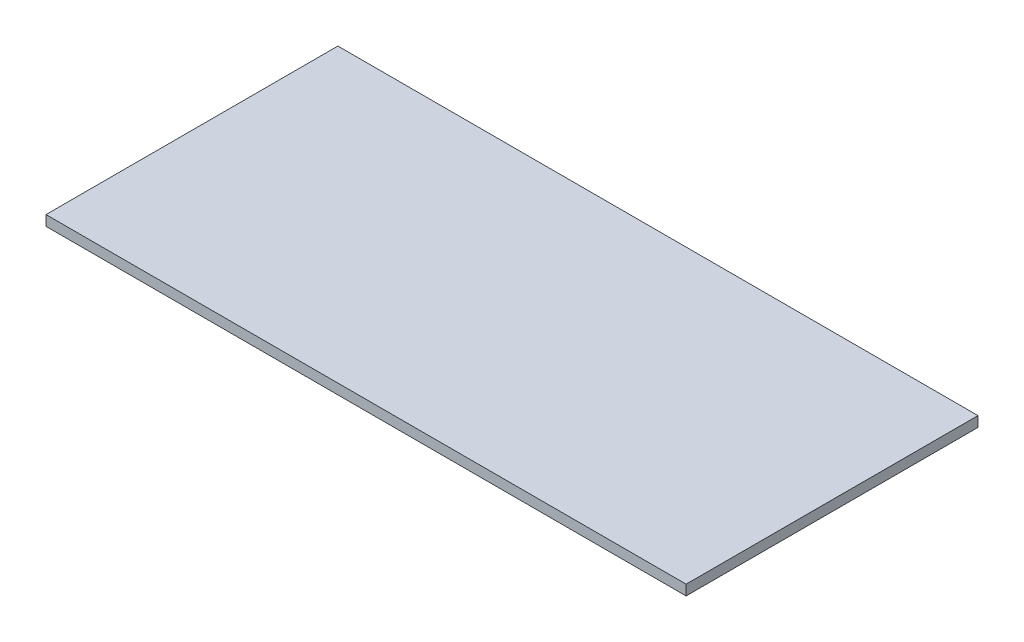
from build123d import *

# Parameters (mm, degrees)
SKETCH1_W           = 250
SKETCH1_H           = 114
BOSS_EXTRUDE1_DEPTH = 4


with BuildPart() as part:
    # Sketch1 → Boss-Extrude1 (new body)
    with BuildSketch(Plane(origin=(0, 0, 0), x_dir=(1, 0, 0), z_dir=(0, 1, 0))):
        with Locations((-3.271186441, -6.279661017)):
            Rectangle(SKETCH1_W, SKETCH1_H)
    extrude(amount=BOSS_EXTRUDE1_DEPTH)


solid = part.part
